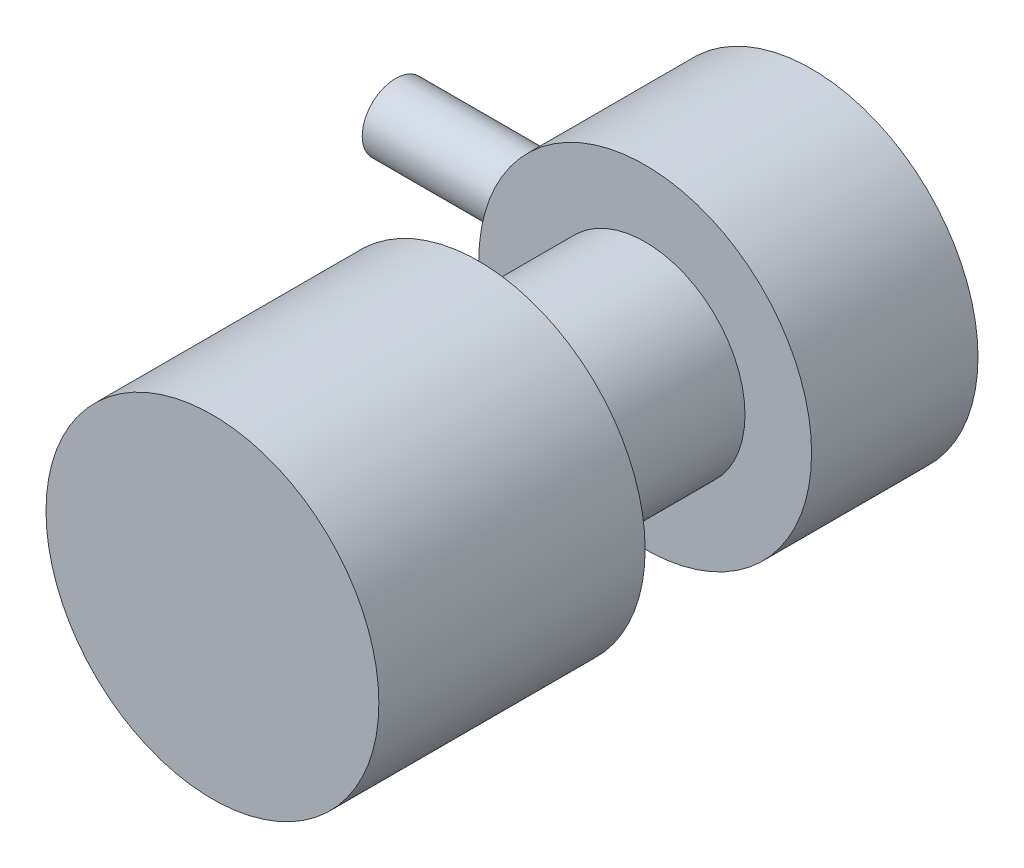
from build123d import *

# Parameters (mm, degrees)
SKETCH2_R           = 5
BOSS_EXTRUDE1_DEPTH = 5
SKETCH3_R           = 3
BOSS_EXTRUDE2_DEPTH = 5
SKETCH4_R           = 5
BOSS_EXTRUDE3_DEPTH = 8
SKETCH5_R           = 1
BOSS_EXTRUDE4_DEPTH = 10


with BuildPart() as part:
    # Sketch2 → Boss-Extrude1 (new body)
    with BuildSketch(Plane.XY):
        Circle(SKETCH2_R)
    extrude(amount=BOSS_EXTRUDE1_DEPTH)

    # Sketch3 → Boss-Extrude2 (add)
    with BuildSketch(Plane.XY.offset(5)):
        Circle(SKETCH3_R)
    extrude(amount=BOSS_EXTRUDE2_DEPTH)

    # Sketch4 → Boss-Extrude3 (add)
    with BuildSketch(Plane.XY.offset(10)):
        Circle(SKETCH4_R)
    extrude(amount=BOSS_EXTRUDE3_DEPTH)

    # Sketch5 → Boss-Extrude4 (add)
    with BuildSketch(Plane.ZY):
        with Locations((2.5, 0)):
            Circle(SKETCH5_R)
    extrude(amount=BOSS_EXTRUDE4_DEPTH)


solid = part.part
